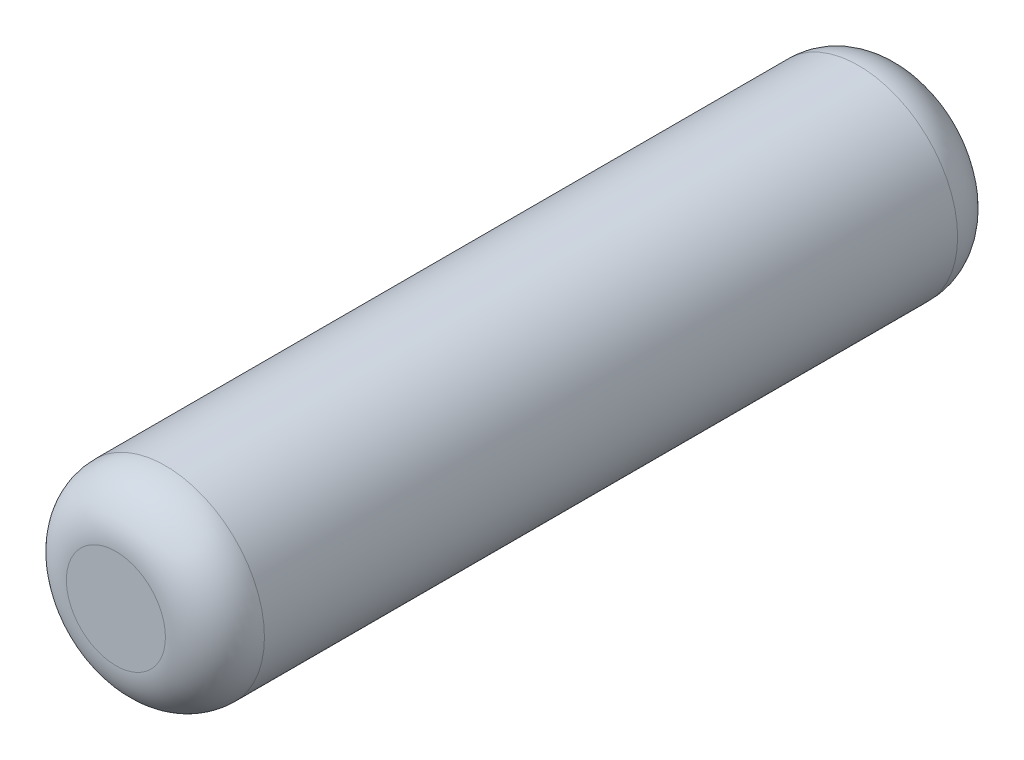
from build123d import *

# Parameters (mm, degrees)
SKETCH1_R           = 50
BOSS_EXTRUDE1_DEPTH = 200
FILLET1_R           = 25


with BuildPart() as part:
    # Sketch1 → Boss-Extrude1 (new, symmetric)
    with BuildSketch(Plane.XY):
        Circle(SKETCH1_R)
    extrude(amount=BOSS_EXTRUDE1_DEPTH, both=True)

    # Fillet1
    fillet1_edges = [part.edges().sort_by_distance(p)[0] for p in [
        (-50, 0, -200),
        (-50, 0, 200),
    ]]
    fillet(fillet1_edges, radius=FILLET1_R)


solid = part.part
